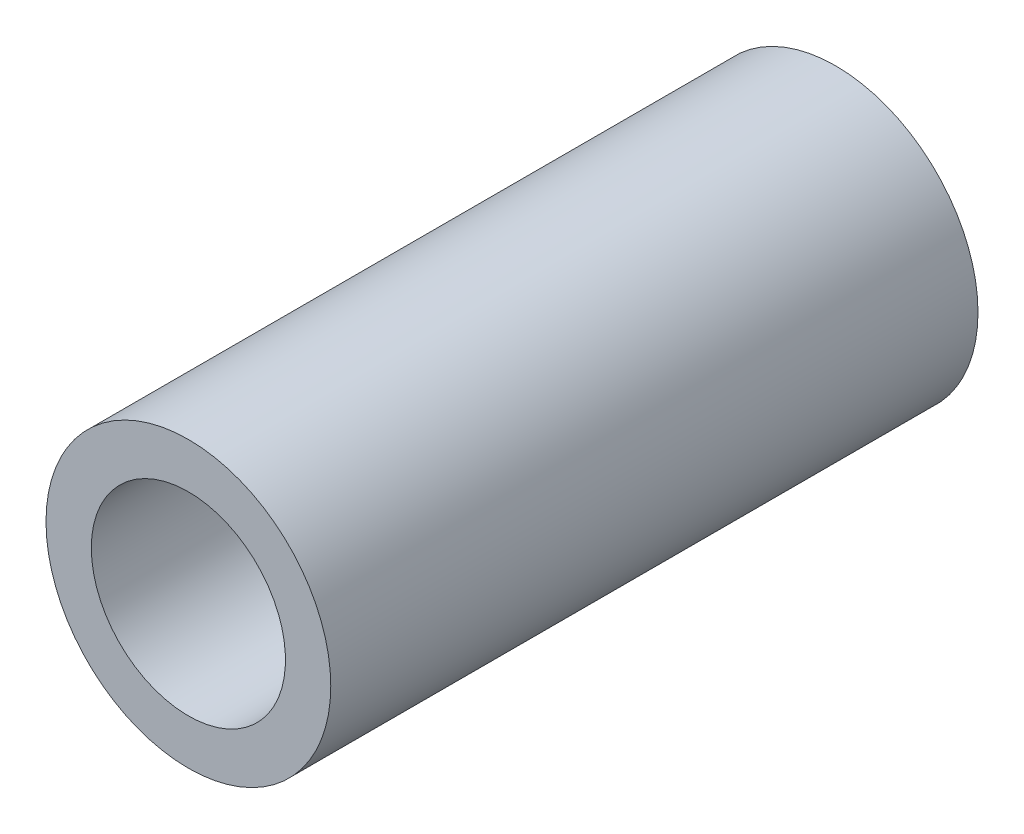
from build123d import *

# Parameters (mm, degrees)
ESQUISSE2_R             = 22
BOSS_EXTRU_2_DEPTH      = 100
ESQUISSE3_R             = 15
ENL_V_MAT_EXTRU_2_DEPTH = 100


with BuildPart() as part:
    # Esquisse2 → Boss.-Extru.2 (new body)
    with BuildSketch(Plane.XY):
        Circle(ESQUISSE2_R)
    extrude(amount=BOSS_EXTRU_2_DEPTH)

    # Esquisse3 → Enlèv. mat.-Extru.2 (cut)
    with BuildSketch(Plane(origin=(0, 0, 0), x_dir=(-1, 0, 0), z_dir=(0, 0, -1))):
        Circle(ESQUISSE3_R)
    extrude(amount=-ENL_V_MAT_EXTRU_2_DEPTH, mode=Mode.SUBTRACT)


solid = part.part
